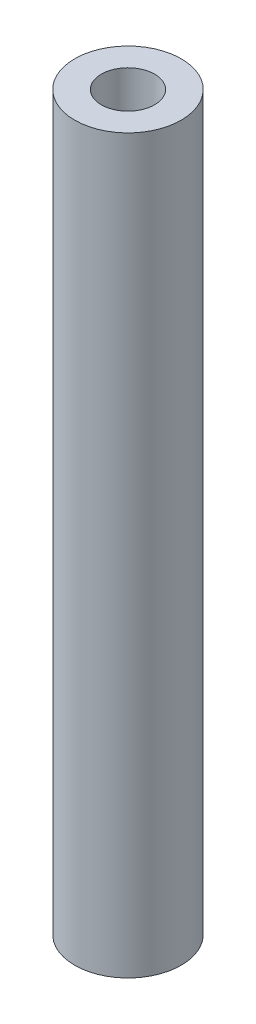
from build123d import *

# Parameters (mm, degrees)
SKETCH1_R           = 2.54
SKETCH1_R_2         = 1.27
BOSS_EXTRUDE1_DEPTH = 17.4625


with BuildPart() as part:
    # Sketch1 → Boss-Extrude1 (new, symmetric)
    with BuildSketch(Plane(origin=(0, 0, 0), x_dir=(1, 0, 0), z_dir=(0, 1, 0))):
        with Locations(Location((0, 0, 0), (0, 0, 270))):
            Circle(SKETCH1_R)
        with Locations(Location((0, 0, 0), (0, 0, 270))):
            Circle(SKETCH1_R_2, mode=Mode.SUBTRACT)
    extrude(amount=BOSS_EXTRUDE1_DEPTH, both=True)


solid = part.part
